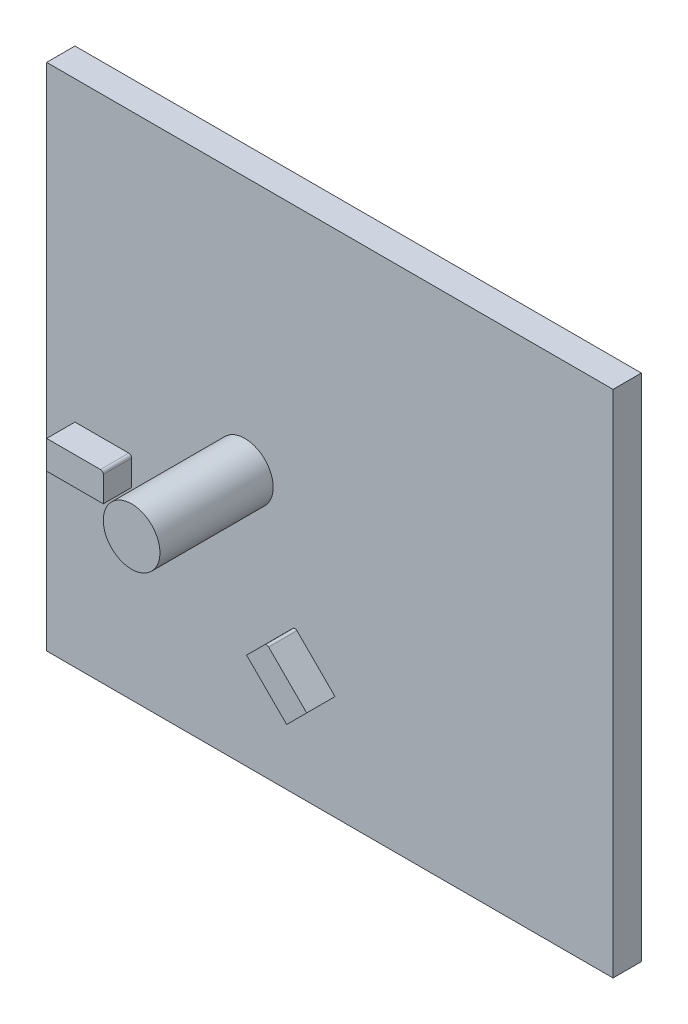
from build123d import *

# Parameters (mm, degrees)
ESQUISSE1_W        = 200
ESQUISSE1_H        = 180
ESQUISSE1_R        = 10
BOSS_EXTRU_1_DEPTH = 10
ESQUISSE3_R        = 10
BOSS_EXTRU_2_DEPTH = 50
ESQUISSE4_W        = 20
ESQUISSE4_H        = 10
BOSS_EXTRU_3_DEPTH = 10
CONG_1_R           = 1


with BuildPart() as part:
    # Esquisse1 → Boss.-Extru.1 (new body)
    with BuildSketch(Plane.XY):
        Rectangle(ESQUISSE1_W, ESQUISSE1_H)
        with Locations((-30, 0)):
            Circle(ESQUISSE1_R, mode=Mode.SUBTRACT)
    extrude(amount=BOSS_EXTRU_1_DEPTH)

    # Esquisse3 → Boss.-Extru.2 (add)
    with BuildSketch(Plane(origin=(0, 0, 0), x_dir=(-1, 0, 0), z_dir=(0, 0, -1))):
        with Locations((30, 0)):
            Circle(ESQUISSE3_R)
    extrude(amount=-BOSS_EXTRU_2_DEPTH)

    # Esquisse4 → Boss.-Extru.3 (add)
    with BuildSketch(Plane.XY.offset(10)):
        with Locations((-80, -20)):
            Rectangle(ESQUISSE4_W, ESQUISSE4_H)
        Polygon((-12.32233047, -38.890872965), (1.819805153, -53.033008589), (-5.251262658, -60.104076401), (-19.393398282, -45.961940777), align=None)
    extrude(amount=BOSS_EXTRU_3_DEPTH)

    # Congé1
    cong_1_edges = [part.edges().sort_by_distance(p)[0] for p in [
        (-70, -15, 15),
        (-12.32233047, -38.890872965, 15),
    ]]
    fillet(cong_1_edges, radius=CONG_1_R)


solid = part.part
